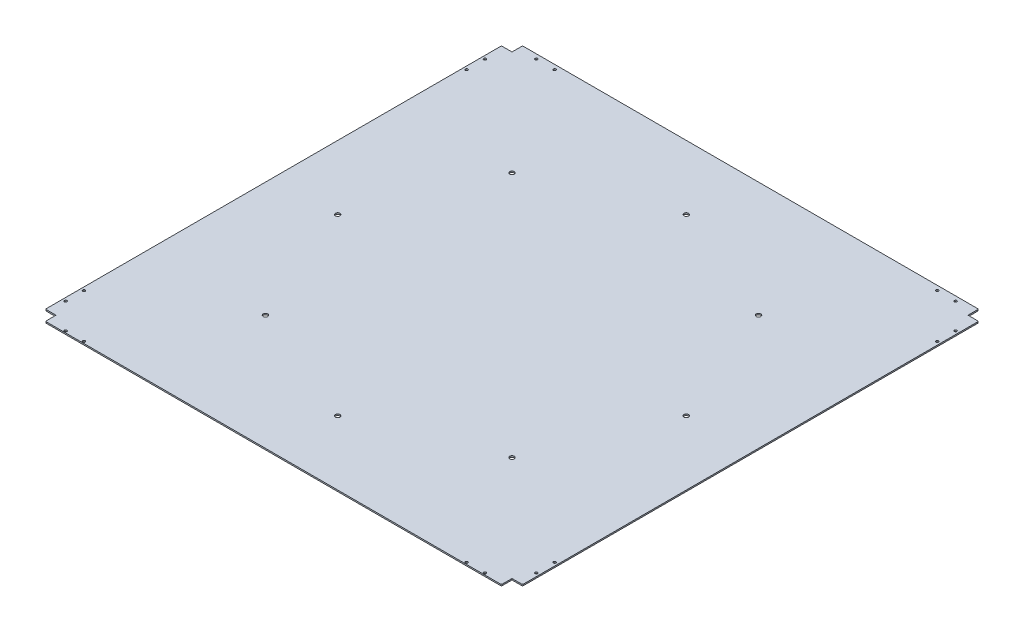
from build123d import *

# Parameters (mm, degrees)
EXTRUDE_3_DEPTH     = 3
SKETCH_2_R          = 5
SKETCH_2_R_2        = 2.75
CUT_EXTRUDE_1_DEPTH = 736.397171602


with BuildPart() as part:
    # 草图1 → 凸台-拉伸3 (new body)
    with BuildSketch(Plane(origin=(0, 0, 0), x_dir=(1, 0, 0), z_dir=(0, 1, 0))):
        with BuildLine():
            Line((0, 520), (-495, 520))
            ThreePointArc((-495, 520), (-496.414213562, 519.414213562), (-497, 518))
            Line((-497, 518), (-497, 497))
            Line((-497, 497), (-518, 497))
            ThreePointArc((-518, 497), (-519.414213562, 496.414213562), (-520, 495))
            Line((-520, 495), (-520, 0))
            Line((-520, 0), (-520, -495))
            ThreePointArc((-520, -495), (-519.414213562, -496.414213562), (-518, -497))
            Line((-518, -497), (-497, -497))
            Line((-497, -497), (-497, -518))
            ThreePointArc((-497, -518), (-496.414213562, -519.414213562), (-495, -520))
            Line((-495, -520), (0, -520))
            Line((0, -520), (495, -520))
            ThreePointArc((495, -520), (496.414213562, -519.414213562), (497, -518))
            Line((497, -518), (497, -497))
            Line((497, -497), (518, -497))
            ThreePointArc((518, -497), (519.414213562, -496.414213562), (520, -495))
            Line((520, -495), (520, 0))
            Line((520, 0), (520, 495))
            ThreePointArc((520, 495), (519.414213562, 496.414213562), (518, 497))
            Line((518, 497), (497, 497))
            Line((497, 497), (497, 518))
            ThreePointArc((497, 518), (496.414213562, 519.414213562), (495, 520))
            Line((495, 520), (0, 520))
        make_face()
    extrude(amount=EXTRUDE_3_DEPTH)

    # 草图2 → 切除-拉伸1 (cut, through all)
    with BuildSketch(Plane(origin=(0, 3, 0), x_dir=(1, 0, 0), z_dir=(0, 1, 0))):
        with Locations(Location((380, 0, 0), (0, 0, 270))):
            Circle(SKETCH_2_R)
        with Locations(Location((268.700576851, -268.700576851, 0), (0, 0, 270))):
            Circle(SKETCH_2_R)
        with Locations(Location((0, -380, 0), (0, 0, 270))):
            Circle(SKETCH_2_R)
        with Locations(Location((-268.700576851, -268.700576851, 0), (0, 0, 270))):
            Circle(SKETCH_2_R)
        with Locations(Location((-380, 0, 0), (0, 0, 270))):
            Circle(SKETCH_2_R)
        with Locations(Location((-268.700576851, 268.700576851, 0), (0, 0, 270))):
            Circle(SKETCH_2_R)
        with Locations(Location((0, 380, 0), (0, 0, 270))):
            Circle(SKETCH_2_R)
        with Locations(Location((268.700576851, 268.700576851, 0), (0, 0, 270))):
            Circle(SKETCH_2_R)
        with Locations(Location((457, 510, 0), (0, 0, 270))):
            Circle(SKETCH_2_R_2)
        with Locations(Location((417, 510, 0), (0, 0, 270))):
            Circle(SKETCH_2_R_2)
        with Locations(Location((-417, 510, 0), (0, 0, 90))):
            Circle(SKETCH_2_R_2)
        with Locations(Location((-457, 510, 0), (0, 0, 90))):
            Circle(SKETCH_2_R_2)
        with Locations(Location((513, -460, 0), (0, 0, 270))):
            Circle(SKETCH_2_R_2)
        with Locations(Location((513, -420, 0), (0, 0, 270))):
            Circle(SKETCH_2_R_2)
        with Locations(Location((513, 454, 0), (0, 0, 90))):
            Circle(SKETCH_2_R_2)
        with Locations(Location((513, 414, 0), (0, 0, 90))):
            Circle(SKETCH_2_R_2)
        with Locations(Location((-457, -516, 0), (0, 0, 270))):
            Circle(SKETCH_2_R_2)
        with Locations(Location((-417, -516, 0), (0, 0, 270))):
            Circle(SKETCH_2_R_2)
        with Locations(Location((457, -516, 0), (0, 0, 90))):
            Circle(SKETCH_2_R_2)
        with Locations(Location((417, -516, 0), (0, 0, 90))):
            Circle(SKETCH_2_R_2)
        with Locations(Location((-513, 454, 0), (0, 0, 270))):
            Circle(SKETCH_2_R_2)
        with Locations(Location((-513, 414, 0), (0, 0, 270))):
            Circle(SKETCH_2_R_2)
        with Locations(Location((-513, -460, 0), (0, 0, 90))):
            Circle(SKETCH_2_R_2)
        with Locations(Location((-513, -420, 0), (0, 0, 90))):
            Circle(SKETCH_2_R_2)
    extrude(amount=-CUT_EXTRUDE_1_DEPTH, mode=Mode.SUBTRACT)


solid = part.part
